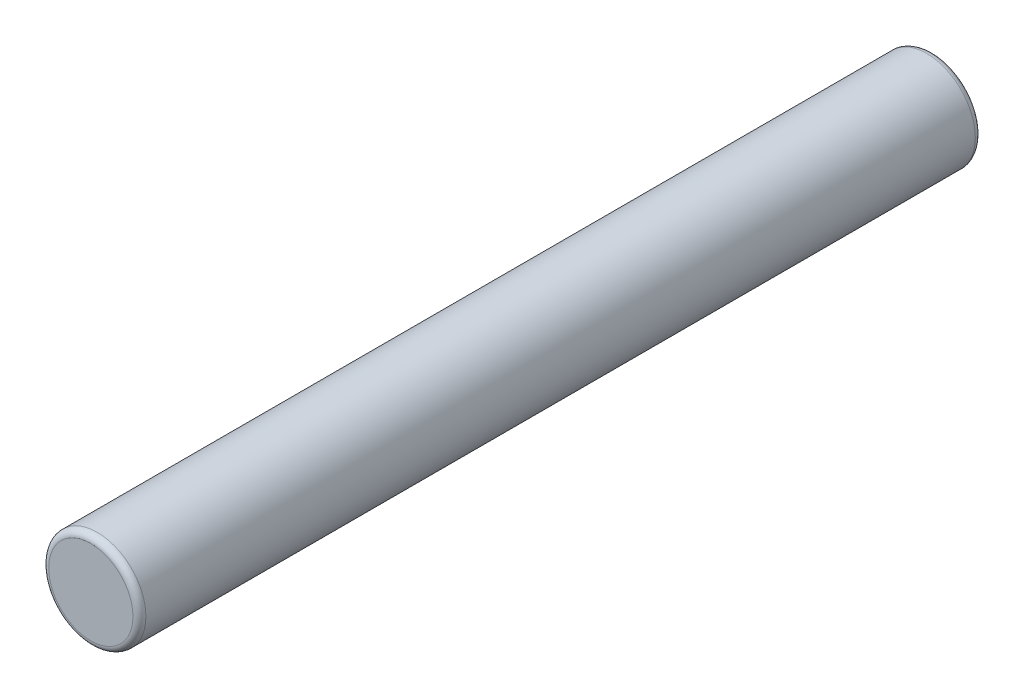
from build123d import *

# Parameters (mm, degrees)
SKETCH1_R           = 1.5
BOSS_EXTRUDE1_DEPTH = 26
FILLET1_R           = 0.2


with BuildPart() as part:
    # Sketch1 → Boss-Extrude1 (new body)
    with BuildSketch(Plane.XY):
        with Locations(Location((0, 0, 0), (0, 0, 180))):
            Circle(SKETCH1_R)
    extrude(amount=BOSS_EXTRUDE1_DEPTH)

    # Fillet1
    fillet1_edges = [part.edges().sort_by_distance(p)[0] for p in [
        (1.5, 0, 0),
        (1.5, 0, 26),
    ]]
    fillet(fillet1_edges, radius=FILLET1_R)


solid = part.part
